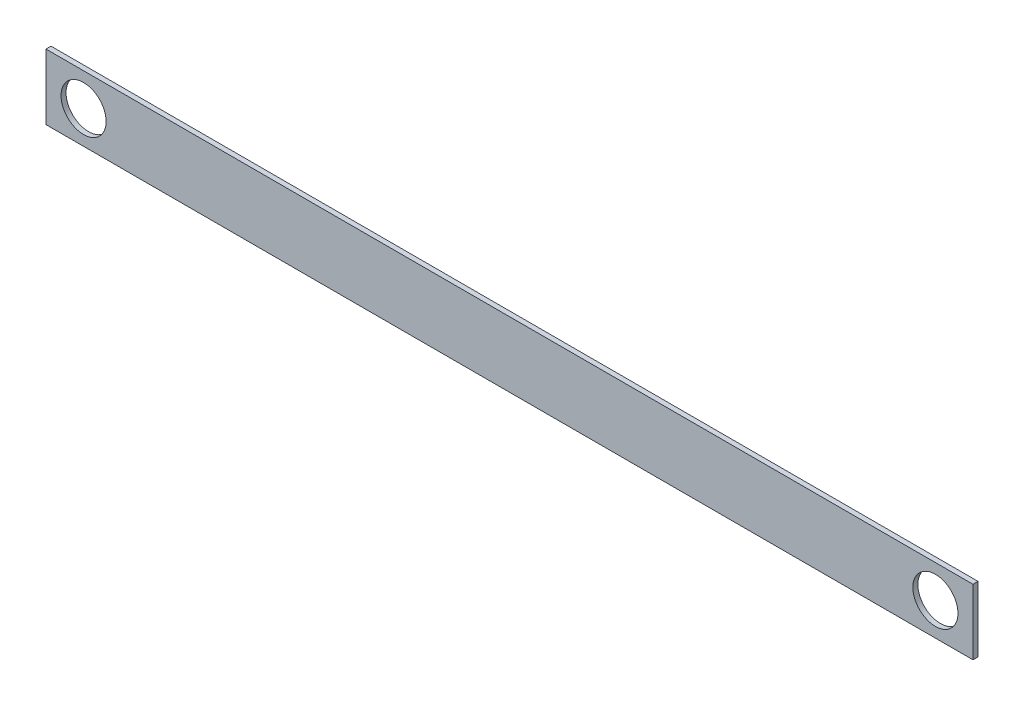
from build123d import *

# Parameters (mm, degrees)
SKETCH1_W           = 370
SKETCH1_H           = 26.131621187
BOSS_EXTRUDE1_DEPTH = 2
SKETCH2_R           = 9
CUT_EXTRUDE1_DEPTH  = 2
SKETCH2_4_R         = 9
CUT_EXTRUDE2_DEPTH  = 2


with BuildPart() as part:
    # Sketch1 → Boss-Extrude1 (new body)
    with BuildSketch(Plane.XY):
        with Locations((60.280898876, 7.126805778)):
            Rectangle(SKETCH1_W, SKETCH1_H)
    extrude(amount=BOSS_EXTRUDE1_DEPTH)

    # Sketch2 → Cut-Extrude1 (cut)
    with BuildSketch(Plane.XY.offset(2)):
        with Locations((-109.719101124, 7.126805778)):
            Circle(SKETCH2_R)
    extrude(amount=-CUT_EXTRUDE1_DEPTH, mode=Mode.SUBTRACT)

    # Sketch2<4> → Cut-Extrude2 (cut)
    with BuildSketch(Plane.XY.offset(2)):
        with Locations((-109.719101124, 7.126805778)):
            Circle(SKETCH2_4_R)
        with Locations((230.280898876, 7.126805778)):
            Circle(SKETCH2_4_R)
    extrude(amount=-CUT_EXTRUDE2_DEPTH, mode=Mode.SUBTRACT)


solid = part.part
